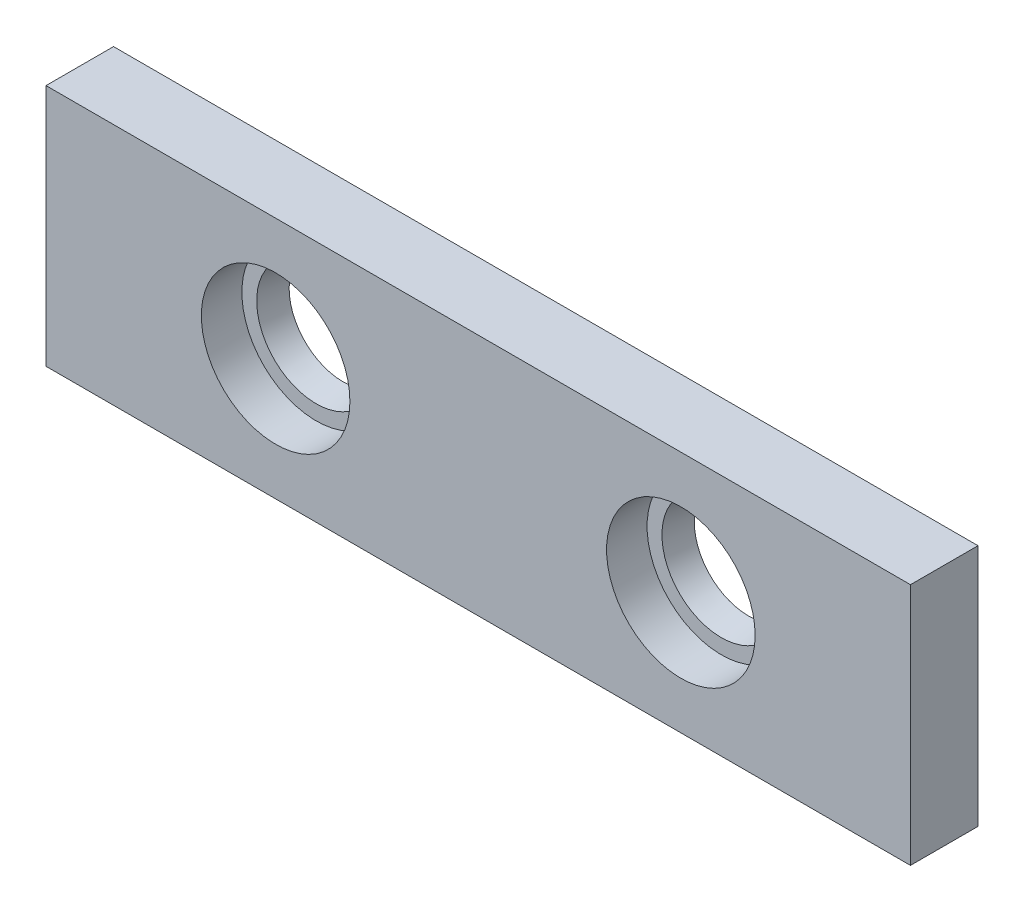
from build123d import *

# Parameters (mm, degrees)
SKETCH_1_W          = 64
SKETCH_1_H          = 18
SKETCH_1_R          = 3
EXTRUDE_1_DEPTH     = 5
SKETCH_2_R          = 5.5
CUT_EXTRUDE_1_DEPTH = 3


with BuildPart() as part:
    # 草图1 → 凸台-拉伸1 (new body)
    with BuildSketch(Plane.XY):
        with Locations((3.920861217, 0.862610936)):
            Rectangle(SKETCH_1_W, SKETCH_1_H)
        with Locations((-11.079138783, 0.862610936)):
            Circle(SKETCH_1_R, mode=Mode.SUBTRACT)
        with Locations((18.920861217, 0.862610936)):
            Circle(SKETCH_1_R, mode=Mode.SUBTRACT)
    extrude(amount=EXTRUDE_1_DEPTH)

    # 草图2 → 切除-拉伸1 (cut)
    with BuildSketch(Plane.XY.offset(5)):
        with Locations((-11.079138783, 0.862610936)):
            Circle(SKETCH_2_R)
        with Locations((18.920861217, 0.862610936)):
            Circle(SKETCH_2_R)
    extrude(amount=-CUT_EXTRUDE_1_DEPTH, mode=Mode.SUBTRACT)

    # 草图5 → 切除-旋转1 (revolve, cut)
    with BuildSketch(Plane(origin=(0, 0.862610936, 0), x_dir=(1, 0, 0), z_dir=(0, 1, 0))):
        Polygon((-15.079138783, 0), (-16.079138783, -5), (-11.079138783, -5), (-11.079138783, 0), align=None)
    revolve(axis=Axis((-11.079138783, 0.862610936, 0), (0, 0, 1)), mode=Mode.SUBTRACT)

    # 草图5<4> → 切除-旋转2 (revolve, cut)
    with BuildSketch(Plane(origin=(0, 0.862610936, 0), x_dir=(1, 0, 0), z_dir=(0, 1, 0))):
        Polygon((23.920999606, -5), (22.920999606, 0), (18.920999606, 0), (18.920999606, -5), align=None)
    revolve(axis=Axis((18.920999606, 0.862610936, 0), (0, 0, 1)), mode=Mode.SUBTRACT)


solid = part.part
